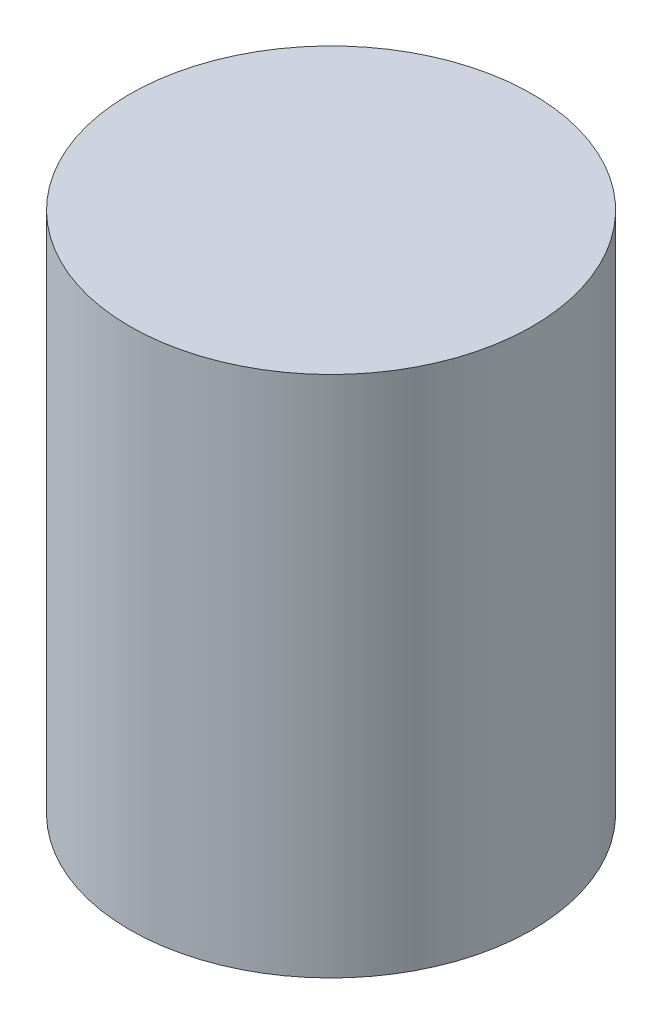
from build123d import *

# Parameters (mm, degrees)
SKETCH1_R           = 19.25
BOSS_EXTRUDE1_DEPTH = 50


with BuildPart() as part:
    # Sketch1 → Boss-Extrude1 (new body)
    with BuildSketch(Plane(origin=(0, 0, 0), x_dir=(1, 0, 0), z_dir=(0, 1, 0))):
        with Locations(Location((0, 0, 0), (0, 0, 270))):
            Circle(SKETCH1_R)
    extrude(amount=BOSS_EXTRUDE1_DEPTH)


solid = part.part
